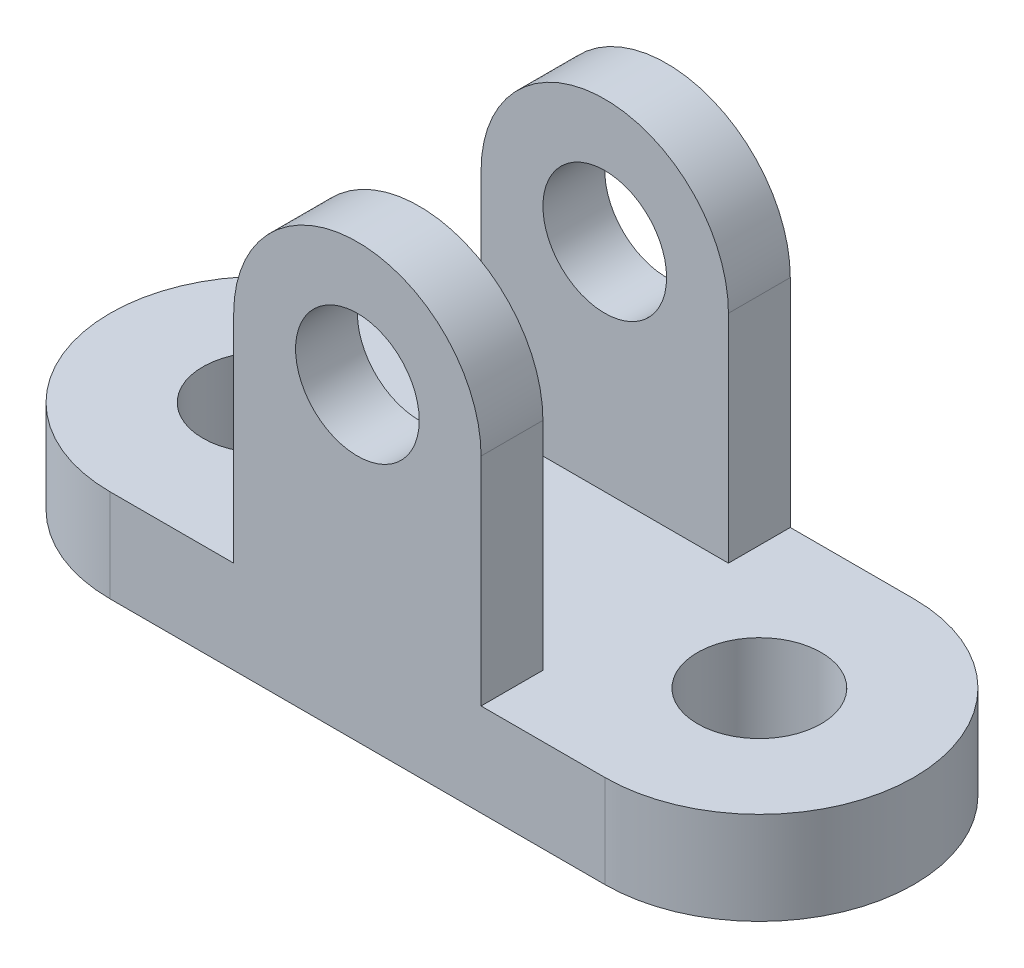
from build123d import *

# Parameters (mm, degrees)
BOSS_EXTRUDE1_DEPTH   = 15
SKETCH3_W             = 40
SKETCH3_H             = 55
BOSS_EXTRUDE2_DEPTH   = 25
FILLET1_RADIUS        = 20
FILLET1_LENGTH        = 50
SKETCH4_W             = 138.127107653
SKETCH4_H             = 30
CUT_EXTRUDE1_DEPTH    = 89.741196746
F_1_0MM_DOWEL_HOLE1_D = 20
F_1_0MM_DOWEL_HOLE2_D = 20


with BuildPart() as part:
    # Sketch1 → Boss-Extrude1 (new body)
    with BuildSketch(Plane(origin=(0, 0, 0), x_dir=(1, 0, 0), z_dir=(0, 1, 0))):
        with BuildLine():
            Line((-40, 25), (40, 25))
            ThreePointArc((40, 25), (65, 0), (40, -25))
            Line((40, -25), (-40, -25))
            ThreePointArc((-40, -25), (-65, 0), (-40, 25))
        make_face()
    extrude(amount=BOSS_EXTRUDE1_DEPTH)

    # Sketch3 → Boss-Extrude2 (add, symmetric)
    with BuildSketch(Plane.XY):
        with Locations((0, 42.5)):
            Rectangle(SKETCH3_W, SKETCH3_H)
    extrude(amount=BOSS_EXTRUDE2_DEPTH, both=True)

    # Fillet1: full round fillet: the end face becomes a half cylinder, R = half its width
    fillet1_face = Plane((0, 70, 0), x_dir=(0, 0, 1), z_dir=(0, 1, 0))  # on the end face: x along it, z out of the body
    fillet1_slab = fillet1_face.offset(-FILLET1_RADIUS / 2) * Box(FILLET1_LENGTH, 2 * FILLET1_RADIUS, FILLET1_RADIUS, mode=Mode.PRIVATE)  # the body's end, R deep
    fillet1_round = Plane((0, 50, 0), x_dir=(0, 1, 0), z_dir=(0, 0, 1)) * Cylinder(FILLET1_RADIUS, FILLET1_LENGTH, mode=Mode.PRIVATE)  # its axis R under the face
    add(fillet1_slab - fillet1_round, mode=Mode.SUBTRACT)

    # Sketch4 → Cut-Extrude1 (cut, through all)
    with BuildSketch(Plane(origin=(0, 15, 0), x_dir=(1, 0, 0), z_dir=(0, 1, 0))):
        with Locations((8.902723736, 0)):
            Rectangle(SKETCH4_W, SKETCH4_H)
    extrude(amount=CUT_EXTRUDE1_DEPTH, mode=Mode.SUBTRACT)

    # Ø1.0mm Dowel Hole1 (through all)
    with Locations(Plane(origin=(0, 15, 0), x_dir=(1, 0, 0), z_dir=(0, 1, 0))):
        with Locations((40, 0), (-40, 0)):
            Hole(F_1_0MM_DOWEL_HOLE1_D / 2)

    # Ø1.0mm Dowel Hole2 (through all)
    with Locations(Plane.XY.offset(25)):
        with Locations((0, 50)):
            Hole(F_1_0MM_DOWEL_HOLE2_D / 2)


solid = part.part
